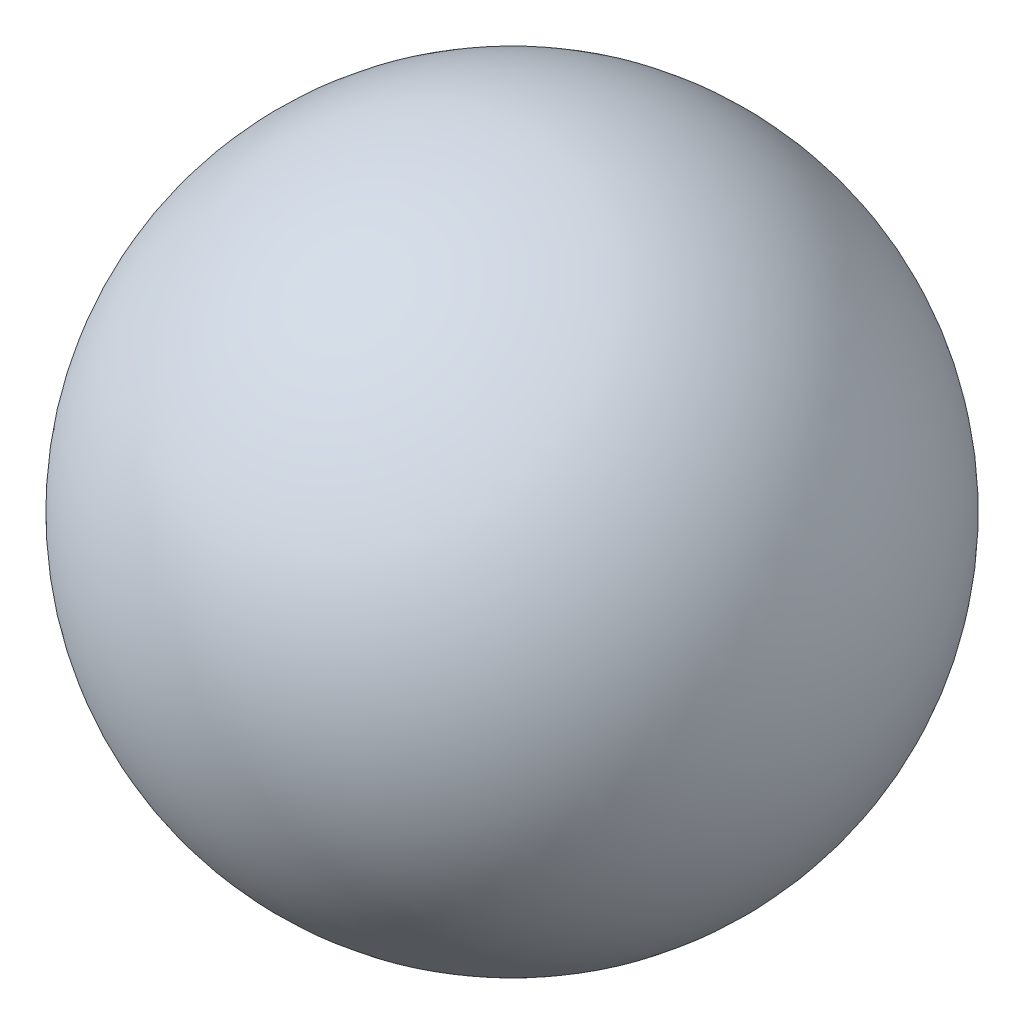
from build123d import *


with BuildPart() as part:
    # 草图1 → 旋转1 (revolve)
    with BuildSketch(Plane.XY):
        with BuildLine():
            Line((0, 0.625), (0, -0.625))
            ThreePointArc((0, -0.625), (0.625, 0), (0, 0.625))
        make_face()
    revolve(axis=Axis((0, 0.625, 0), (0, -1, 0)))


solid = part.part
